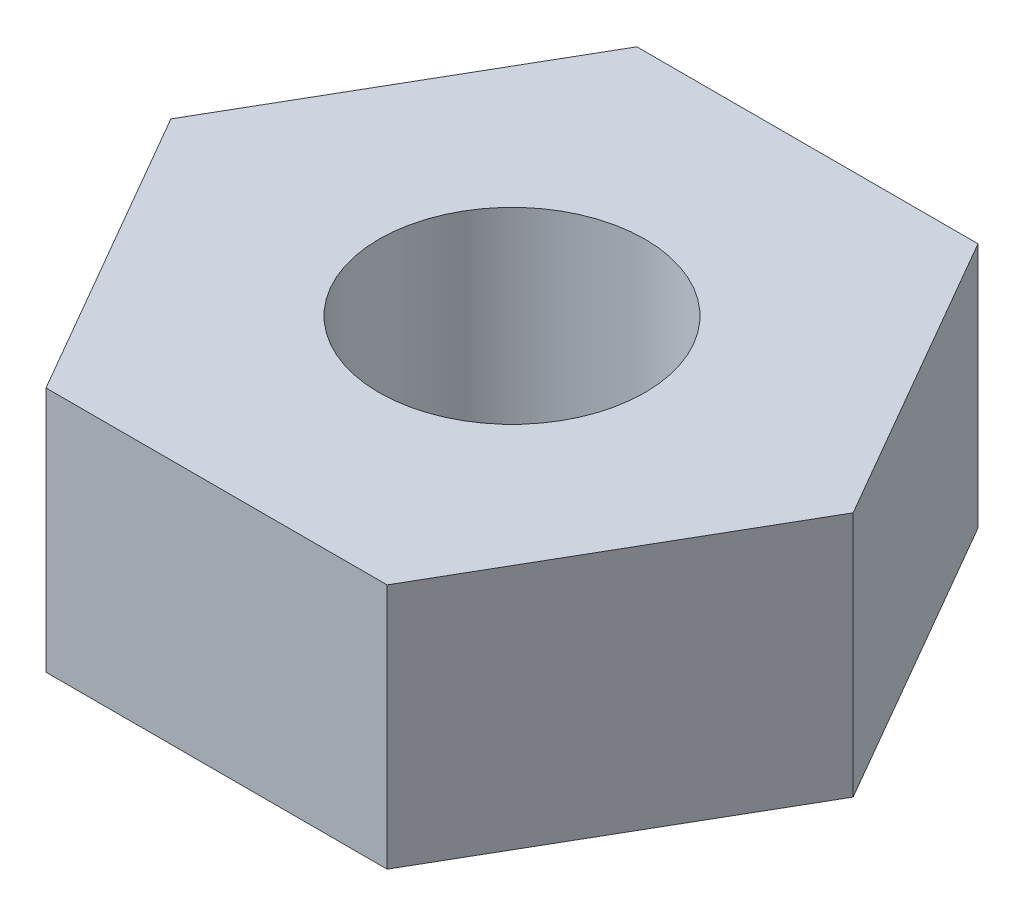
from build123d import *

# Parameters (mm, degrees)
SKETCH1_R           = 1.35
BOSS_EXTRUDE1_DEPTH = 2.5


with BuildPart() as part:
    # Sketch1 → Boss-Extrude1 (new body)
    with BuildSketch(Plane(origin=(0, 0, 0), x_dir=(1, 0, 0), z_dir=(0, 1, 0))):
        Polygon((3.464101615, 0), (1.732050808, 3), (-1.732050808, 3), (-3.464101615, 0), (-1.732050808, -3), (1.732050808, -3), align=None)
        with Locations(Location((0, 0, 0), (0, 0, 270))):
            Circle(SKETCH1_R, mode=Mode.SUBTRACT)
    extrude(amount=BOSS_EXTRUDE1_DEPTH)


solid = part.part
